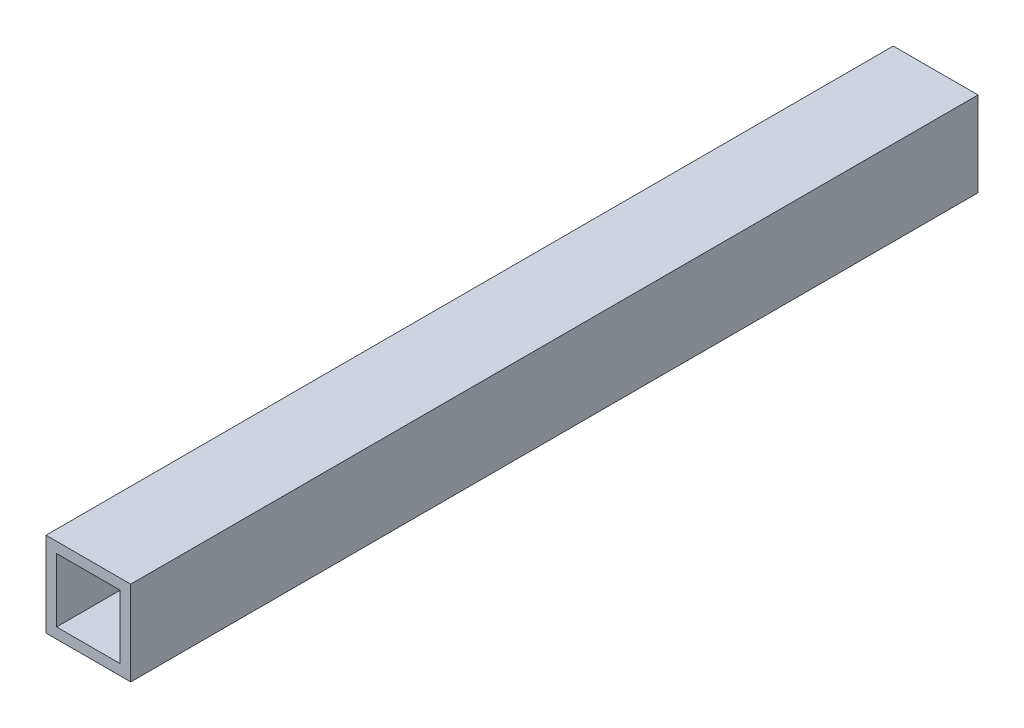
from build123d import *

# Parameters (mm, degrees)
SKETCH_1_W      = 40
SKETCH_1_H      = 40
SKETCH_1_W_2    = 30
SKETCH_1_H_2    = 30
EXTRUDE_1_DEPTH = 400


with BuildPart() as part:
    # Эскиз1 → Вытянуть-Тонкостенный1 (new body)
    with BuildSketch(Plane.XY):
        with Locations((20, 20)):
            Rectangle(SKETCH_1_W, SKETCH_1_H)
        with Locations((20, 20)):
            Rectangle(SKETCH_1_W_2, SKETCH_1_H_2, mode=Mode.SUBTRACT)
    extrude(amount=EXTRUDE_1_DEPTH)


solid = part.part
